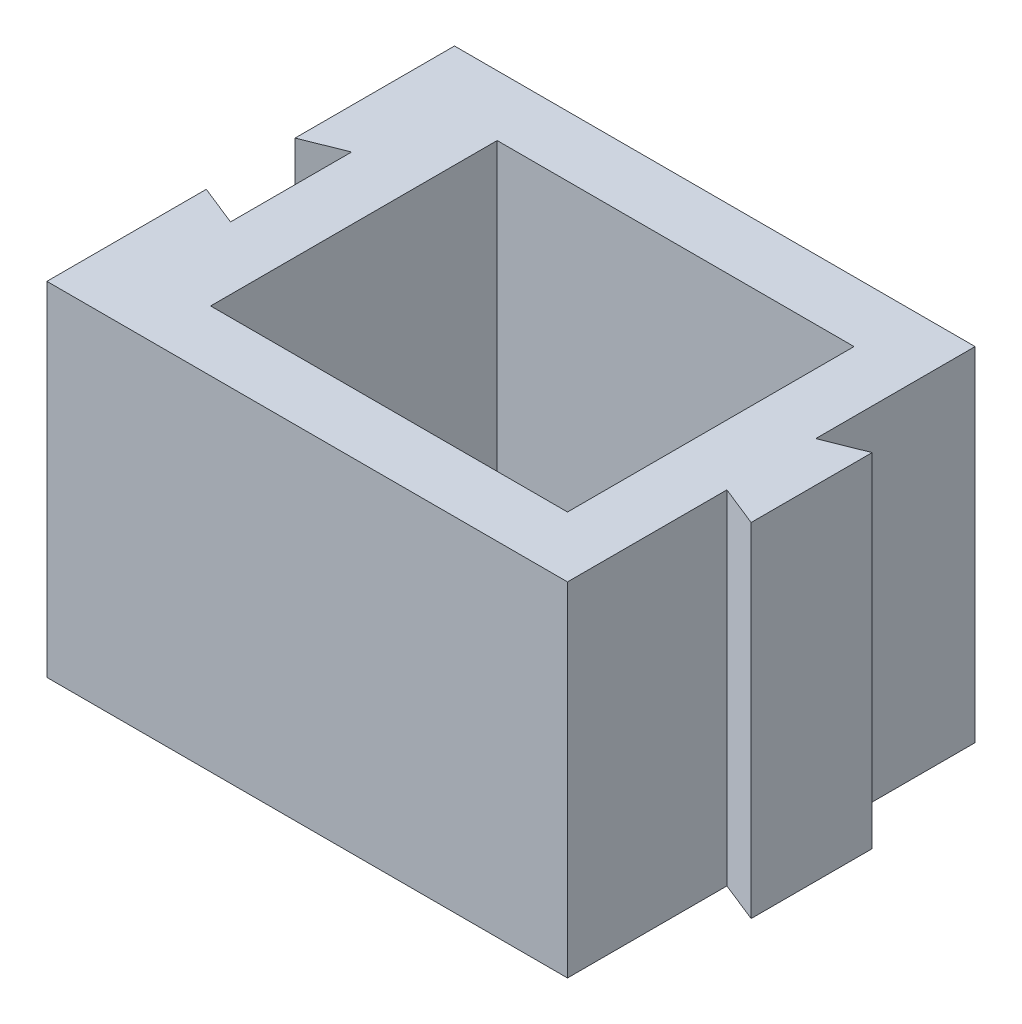
from build123d import *

# Parameters (mm, degrees)
BOSS_EXTRUDE1_DEPTH = 42.5
SKETCH2_W           = 44.214702114
SKETCH2_H           = 35.5
CUT_EXTRUDE1_DEPTH  = 42.5


with BuildPart() as part:
    # Sketch1 → Boss-Extrude1 (new body)
    with BuildSketch(Plane(origin=(0, 0, 0), x_dir=(1, 0, 0), z_dir=(0, 1, 0))):
        Polygon((-32.25, 25.25), (-32.25, 5.5), (-27.25, 7.5), (-27.25, -7.5), (-32.25, -5.5), (-32.25, -25.25), (32.25, -25.25), (32.25, -5.5), (32.25, 5.5), (32.25, 25.25), align=None)
        Polygon((37.25, 7.5), (32.25, 5.5), (32.25, -5.5), (37.25, -7.5), align=None)
    extrude(amount=BOSS_EXTRUDE1_DEPTH)

    # Sketch2 → Cut-Extrude1 (cut)
    with BuildSketch(Plane(origin=(0, 42.5, 0), x_dir=(1, 0, 0), z_dir=(0, 1, 0))):
        with Locations((2.642648943, 0)):
            Rectangle(SKETCH2_W, SKETCH2_H)
    extrude(amount=-CUT_EXTRUDE1_DEPTH, mode=Mode.SUBTRACT)


solid = part.part
